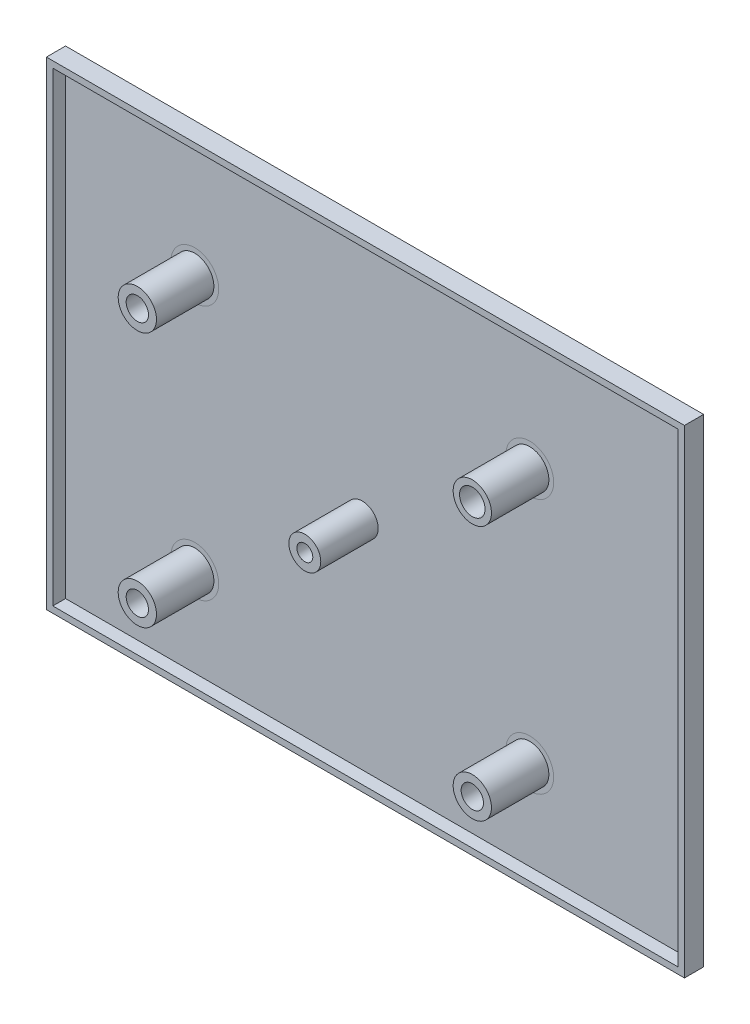
from build123d import *

# Parameters (mm, degrees)
ESQUISSE1_W             = 200
ESQUISSE1_H             = 150
BOSS_EXTRU_1_DEPTH      = 2
ESQUISSE2_R             = 6
ESQUISSE2_R_2           = 5
BOSS_EXTRU_3_DEPTH      = 20
ESQUISSE3_W             = 200
ESQUISSE3_H             = 150
ESQUISSE3_W_2           = 196
ESQUISSE3_H_2           = 146
BOSS_EXTRU_4_DEPTH      = 4
ESQUISSE4_R             = 4
ENL_V_MAT_EXTRU_1_DEPTH = 18
ENL_V_START             = 18
ESQUISSE5_R             = 3.5
ENL_V_MAT_EXTRU_4_DEPTH = 18
ESQUISSE6_R             = 3.5
ENL_V_MAT_EXTRU_6_DEPTH = 18
ESQUISSE7_R             = 3.5
ENL_V_MAT_EXTRU_7_DEPTH = 18
ESQUISSE8_R             = 2.5
ENL_V_MAT_EXTRU_8_DEPTH = 18


with BuildPart() as part:
    # Esquisse1 → Boss.-Extru.1 (new body)
    with BuildSketch(Plane.XY):
        with Locations((100, -75)):
            Rectangle(ESQUISSE1_W, ESQUISSE1_H)
    extrude(amount=BOSS_EXTRU_1_DEPTH)

    # Esquisse2 → Boss.-Extru.3 (add)
    with BuildSketch(Plane.XY):
        with Locations(Location((42.5, -120, 0), (0, 0, 180))):
            Circle(ESQUISSE2_R)
        with Locations(Location((42.5, -40, 0), (0, 0, 180))):
            Circle(ESQUISSE2_R)
        with Locations(Location((147.5, -120, 0), (0, 0, 180))):
            Circle(ESQUISSE2_R)
        with Locations(Location((147.5, -40, 0), (0, 0, 180))):
            Circle(ESQUISSE2_R)
        with Locations(Location((95, -80, 0), (0, 0, 180))):
            Circle(ESQUISSE2_R_2)
    extrude(amount=BOSS_EXTRU_3_DEPTH)

    # Esquisse3 → Boss.-Extru.4 (add)
    with BuildSketch(Plane.XY.offset(2)):
        with Locations((100, -75)):
            Rectangle(ESQUISSE3_W, ESQUISSE3_H)
        with Locations((100, -75)):
            Rectangle(ESQUISSE3_W_2, ESQUISSE3_H_2, mode=Mode.SUBTRACT)
    extrude(amount=BOSS_EXTRU_4_DEPTH)

    # Esquisse4 → Enlèv. mat.-Extru.1 (cut)
    with BuildSketch(Plane.XY.offset(20)):
        with Locations((147.5, -40)):
            Circle(ESQUISSE4_R)
    extrude(amount=-ENL_V_MAT_EXTRU_1_DEPTH, mode=Mode.SUBTRACT)

    # Esquisse5 → Enlèv. mat.-Extru.4 (cut)
    with BuildSketch(Plane.XY.offset(2).offset(ENL_V_START)):
        with Locations((42.5, -40)):
            Circle(ESQUISSE5_R)
    extrude(amount=-ENL_V_MAT_EXTRU_4_DEPTH, mode=Mode.SUBTRACT)

    # Esquisse6 → Enlèv. mat.-Extru.6 (cut)
    with BuildSketch(Plane.XY.offset(2).offset(ENL_V_START)):
        with Locations((147.5, -120)):
            Circle(ESQUISSE6_R)
    extrude(amount=-ENL_V_MAT_EXTRU_6_DEPTH, mode=Mode.SUBTRACT)

    # Esquisse7 → Enlèv. mat.-Extru.7 (cut)
    with BuildSketch(Plane.XY.offset(2).offset(ENL_V_START)):
        with Locations((42.5, -120)):
            Circle(ESQUISSE7_R)
    extrude(amount=-ENL_V_MAT_EXTRU_7_DEPTH, mode=Mode.SUBTRACT)

    # Esquisse8 → Enlèv. mat.-Extru.8 (cut)
    with BuildSketch(Plane.XY.offset(2).offset(ENL_V_START)):
        with Locations((95, -80)):
            Circle(ESQUISSE8_R)
    extrude(amount=-ENL_V_MAT_EXTRU_8_DEPTH, mode=Mode.SUBTRACT)


solid = part.part
